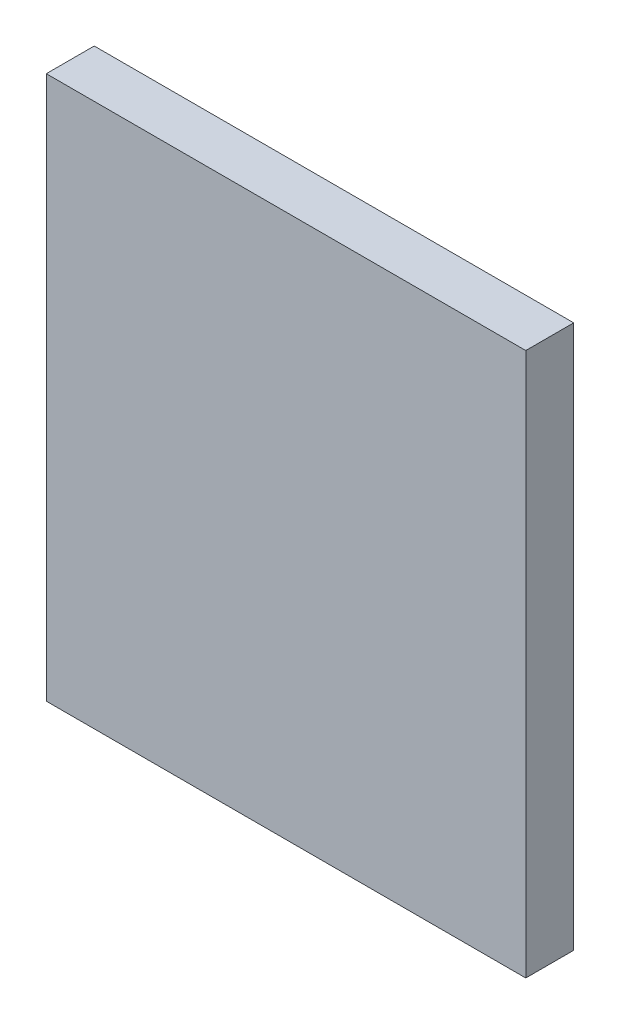
from build123d import *

# Parameters (mm, degrees)
SKETCH_1_W      = 150
SKETCH_1_H      = 170
EXTRUDE_1_DEPTH = 15


with BuildPart() as part:
    # 草图1 → 凸台-拉伸1 (new body)
    with BuildSketch(Plane.XY):
        Rectangle(SKETCH_1_W, SKETCH_1_H)
    extrude(amount=EXTRUDE_1_DEPTH)


solid = part.part
